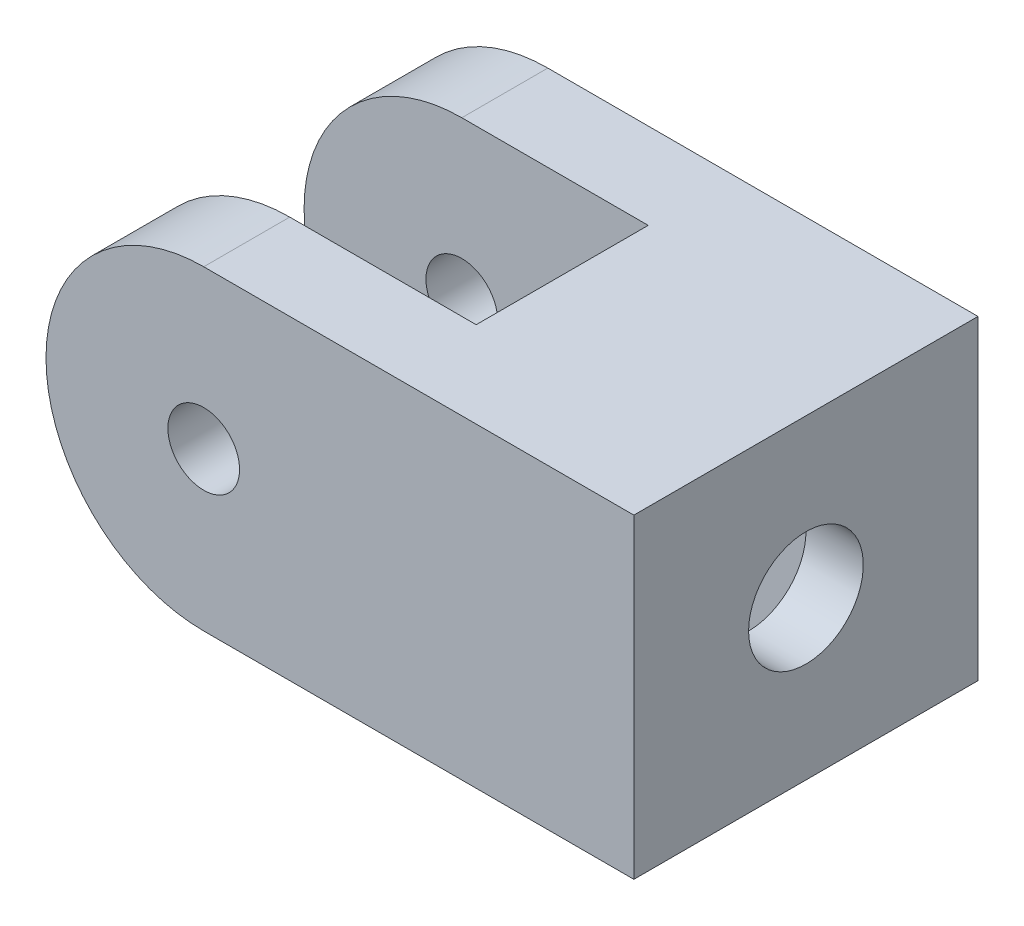
from build123d import *

# Parameters (mm, degrees)
BOSS_EXTRUDE1_DEPTH          = 24
SKETCH2_W                    = 30.110806601
SKETCH2_H                    = 12
CUT_EXTRUDE1_DEPTH           = 45.271887242
CUT_EXTRUDE2_DEPTH           = 6.8
F_7_8_8_DIAMETER_HOLE1_D     = 8
F_7_8_8_DIAMETER_HOLE1_DEPTH = 6.2
F_7_8_8_DIAMETER_HOLE2_D     = 8
F_4_7_5_DIAMETER_HOLE2_D     = 5
F_4_7_5_DIAMETER_HOLE2_DEPTH = 6
F_4_7_5_DIAMETER_HOLE1_D     = 5


with BuildPart() as part:
    # Sketch1 → Boss-Extrude1 (new body)
    with BuildSketch(Plane(origin=(0, 0, -24), x_dir=(-1, 0, 0), z_dir=(0, 0, -1))):
        with BuildLine():
            Line((0, 11), (-30, 11))
            Line((-30, 11), (-30, -11))
            Line((-30, -11), (0, -11))
            ThreePointArc((0, -11), (11, 0), (0, 11))
        make_face()
    extrude(amount=-BOSS_EXTRUDE1_DEPTH)

    # Sketch2 → Cut-Extrude1 (cut, through all)
    with BuildSketch(Plane(origin=(0, 11, 0), x_dir=(-1, 0, 0), z_dir=(0, 1, 0))):
        with Locations((2.055403301, -12)):
            Rectangle(SKETCH2_W, SKETCH2_H)
    extrude(amount=-CUT_EXTRUDE1_DEPTH, mode=Mode.SUBTRACT)

    # Sketch3 → Cut-Extrude2 (cut)
    with BuildSketch(Plane(origin=(19.2, 0, 0), x_dir=(0, -1, 0), z_dir=(-1, 0, 0))):
        Polygon((11, -18.5), (11, -5.5), (-3.75277675, -5.5), (-7.505553499, -12), (-3.75277675, -18.5), align=None)
    extrude(amount=-CUT_EXTRUDE2_DEPTH, mode=Mode.SUBTRACT)

    # Ø7.8 (8) Diameter Hole1
    with Locations(Plane.ZY.offset(-13)):
        with Locations((-12, 0)):
            Hole(F_7_8_8_DIAMETER_HOLE1_D / 2, depth=F_7_8_8_DIAMETER_HOLE1_DEPTH)

    # Ø7.8 (8) Diameter Hole2 (through all)
    with Locations(Plane.ZY.offset(-26)):
        with Locations((-12, 0)):
            Hole(F_7_8_8_DIAMETER_HOLE2_D / 2)

    # Ø4.7 (5) Diameter Hole2
    with Locations(Plane(origin=(0, 0, -24), x_dir=(-1, 0, 0), z_dir=(0, 0, -1))):
        with Locations((0, 0)):
            Hole(F_4_7_5_DIAMETER_HOLE2_D / 2, depth=F_4_7_5_DIAMETER_HOLE2_DEPTH)

    # Ø4.7 (5) Diameter Hole1 (through all)
    with Locations(Plane(origin=(0, 0, -6), x_dir=(-1, 0, 0), z_dir=(0, 0, -1))):
        with Locations((0, 0)):
            Hole(F_4_7_5_DIAMETER_HOLE1_D / 2)


solid = part.part
